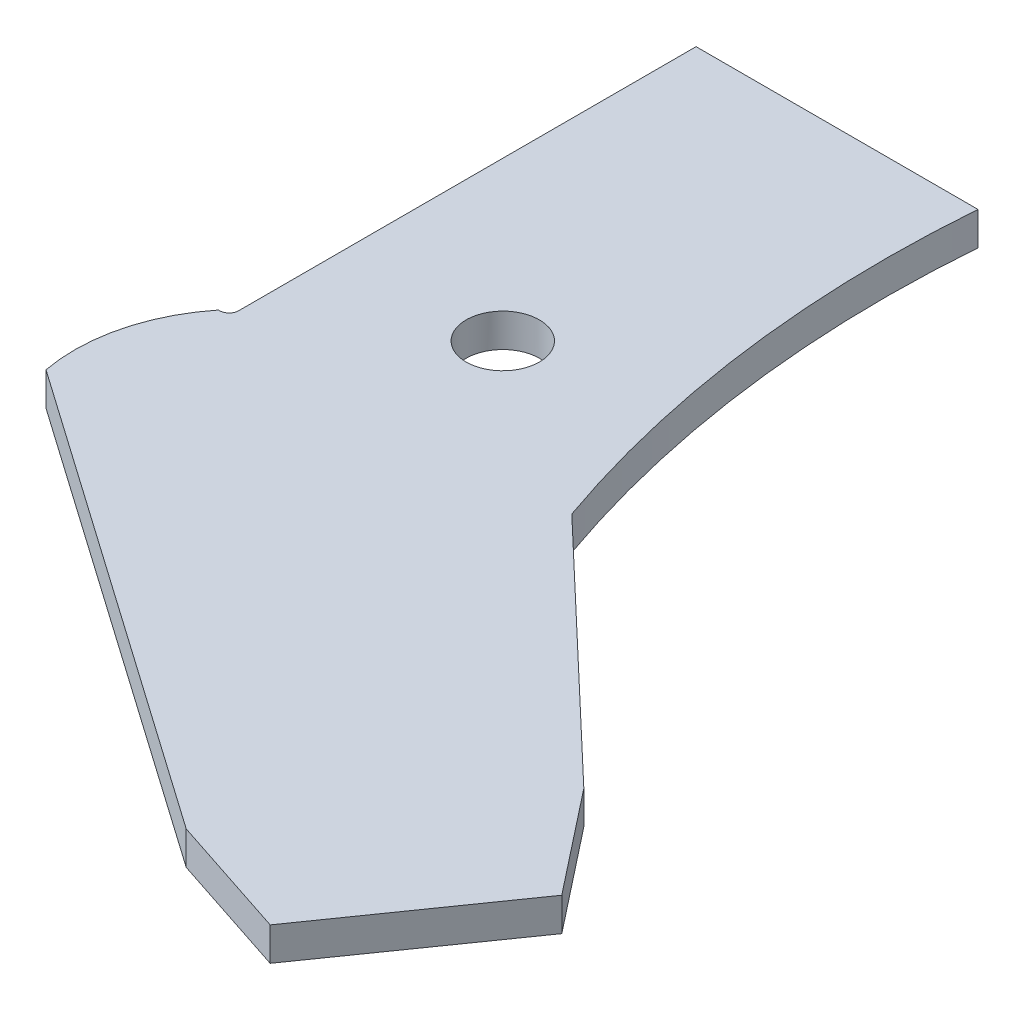
from build123d import *

# Parameters (mm, degrees)
SKETCH1_R           = 7.9375
BOSS_EXTRUDE1_DEPTH = 11.1125
SKETCH2_R           = 12.20390625
CUT_EXTRUDE1_DEPTH  = 11.1125


with BuildPart() as part:
    # Sketch1 → Boss-Extrude1 (new body)
    with BuildSketch(Plane(origin=(0, 0, 0), x_dir=(1, 0, 0), z_dir=(0, 1, 0))):
        with BuildLine():
            Line((47.0296875, 0), (-47.0296875, 0))
            Line((-47.0296875, 0), (-47.0296875, -152.5984375))
            ThreePointArc((-47.0296875, -152.5984375), (-47.95962347, -154.84350153), (-50.2046875, -155.7734375))
            Line((-50.2046875, -155.7734375), (-50.6015625, -155.7734375))
            ThreePointArc((-50.6015625, -155.7734375), (-61.399867308, -177.531283173), (-62.1109375, -201.8109375))
            Line((-62.1109375, -201.8109375), (93.937526937, -311.077248625))
            Line((93.937526937, -311.077248625), (135.682650242, -324.803661369))
            Line((135.682650242, -324.803661369), (175.746964321, -267.585891076))
            Line((175.746964321, -267.585891076), (148.570682499, -233.053016406))
            Line((148.570682499, -233.053016406), (67.2703125, -155.7734375))
            ThreePointArc((67.2703125, -155.7734375), (49.00058662, -78.945623418), (47.0296875, 0))
        make_face()
        with Locations(Location((5.7546875, -117.2765625, 0), (0, 0, 270))):
            Circle(SKETCH1_R, mode=Mode.SUBTRACT)
    extrude(amount=BOSS_EXTRUDE1_DEPTH)

    # Sketch2 → Cut-Extrude1 (cut)
    with BuildSketch(Plane(origin=(0, 11.1125, 0), x_dir=(1, 0, 0), z_dir=(0, 1, 0))):
        with Locations(Location((5.7546875, -117.2765625, 0), (0, 0, 270))):
            Circle(SKETCH2_R)
    extrude(amount=-CUT_EXTRUDE1_DEPTH, mode=Mode.SUBTRACT)


solid = part.part
